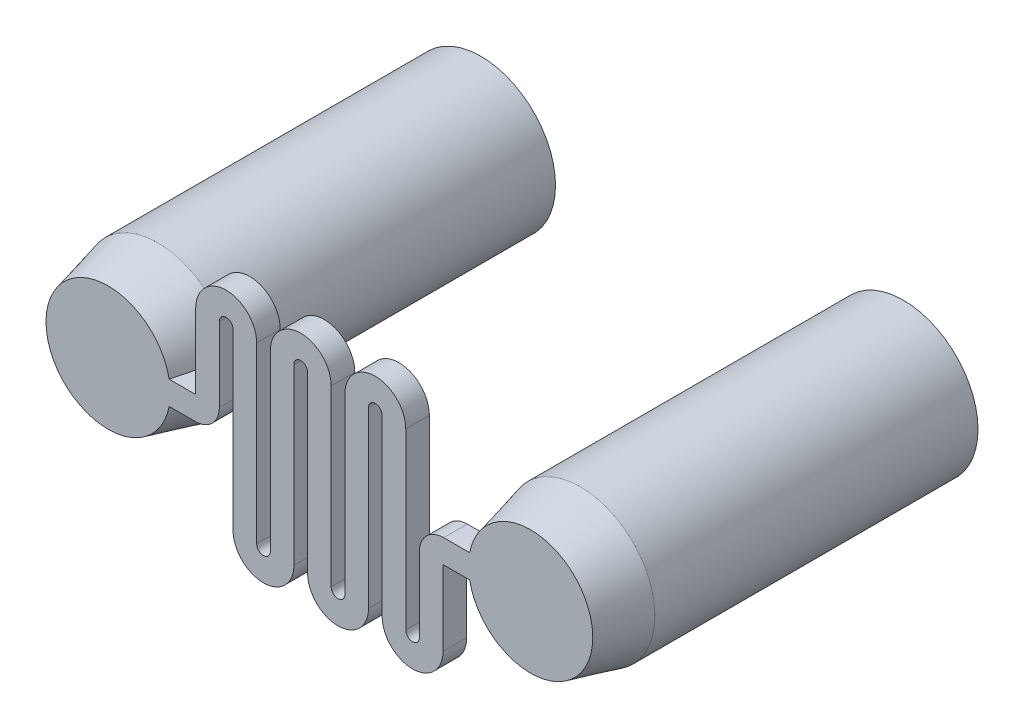
from build123d import *

# Parameters (mm, degrees)
BOSS_EXTRUDE1_DEPTH = 1.9
SKETCH5_R           = 5
CUT_EXTRUDE1_DEPTH  = 28


with BuildPart() as part:
    # Sketch2 → Boss-Extrude1 (new body)
    with BuildSketch(Plane.XY):
        with BuildLine():
            Line((-20.5, -0.95), (-13.5, -0.95))
            ThreePointArc((-13.5, -0.95), (-12.121141777, -0.378858223), (-11.55, 1))
            Line((-11.55, 1), (-11.55, 7))
            ThreePointArc((-11.55, 7), (-11, 7.55), (-10.45, 7))
            Line((-10.45, 7), (-10.45, 0))
            Line((-10.45, 0), (-10.45, -7))
            ThreePointArc((-10.45, -7), (-8, -9.45), (-5.55, -7))
            Line((-5.55, -7), (-5.55, 0))
            Line((-5.55, 0), (-5.55, 7))
            ThreePointArc((-5.55, 7), (-5, 7.55), (-4.45, 7))
            Line((-4.45, 7), (-4.45, 0))
            Line((-4.45, 0), (-4.45, -7))
            ThreePointArc((-4.45, -7), (-2, -9.45), (0.45, -7))
            Line((0.45, -7), (0.45, 0))
            Line((0.45, 0), (0.45, 7))
            ThreePointArc((0.45, 7), (1, 7.55), (1.55, 7))
            Line((1.55, 7), (1.55, 0))
            Line((1.55, 0), (1.55, -7))
            ThreePointArc((1.55, -7), (4, -9.45), (6.45, -7))
            Line((6.45, -7), (6.45, -1))
            ThreePointArc((6.45, -1), (6.464644661, -0.964644661), (6.5, -0.95))
            Line((6.5, -0.95), (13.5, -0.95))
            ThreePointArc((13.5, -0.95), (14.45, 0), (13.5, 0.95))
            Line((13.5, 0.95), (6.5, 0.95))
            ThreePointArc((6.5, 0.95), (5.121141777, 0.378858223), (4.55, -1))
            Line((4.55, -1), (4.55, -7))
            ThreePointArc((4.55, -7), (4, -7.55), (3.45, -7))
            Line((3.45, -7), (3.45, 0))
            Line((3.45, 0), (3.45, 7))
            ThreePointArc((3.45, 7), (1, 9.45), (-1.45, 7))
            Line((-1.45, 7), (-1.45, 0))
            Line((-1.45, 0), (-1.45, -7))
            ThreePointArc((-1.45, -7), (-2, -7.55), (-2.55, -7))
            Line((-2.55, -7), (-2.55, 0))
            Line((-2.55, 0), (-2.55, 7))
            ThreePointArc((-2.55, 7), (-5, 9.45), (-7.45, 7))
            Line((-7.45, 7), (-7.45, 0))
            Line((-7.45, 0), (-7.45, -7))
            ThreePointArc((-7.45, -7), (-8, -7.55), (-8.55, -7))
            Line((-8.55, -7), (-8.55, 0))
            Line((-8.55, 0), (-8.55, 7))
            ThreePointArc((-8.55, 7), (-11, 9.45), (-13.45, 7))
            Line((-13.45, 7), (-13.45, 1))
            ThreePointArc((-13.45, 1), (-13.464644661, 0.964644661), (-13.5, 0.95))
            Line((-13.5, 0.95), (-20.5, 0.95))
            ThreePointArc((-20.5, 0.95), (-21.45, 0), (-20.5, -0.95))
        make_face()
    extrude(amount=BOSS_EXTRUDE1_DEPTH)

    # Sketch3 → Revolve1 (revolve)
    with BuildSketch(Plane(origin=(0, 0, 0), x_dir=(1, 0, 0), z_dir=(0, 1, 0)), mode=Mode.PRIVATE) as revolve1_sk:
        Polygon((-20.5, -1.9), (-25.5, -1.9), (-26.5, 2.1), (-26.5, 28.1), (-20.5, 28.1), align=None)
    revolve(revolve1_sk.sketch.rotate(Axis((-20.5, 0, 1.9), (0, 0, -1)), 190.952784348), axis=Axis((-20.5, 0, 1.9), (0, 0, -1)))

    # Sketch4 → Revolve2 (revolve)
    with BuildSketch(Plane(origin=(0, 0, 0), x_dir=(1, 0, 0), z_dir=(0, 1, 0)), mode=Mode.PRIVATE) as revolve2_sk:
        Polygon((13.5, -1.9), (18.5, -1.9), (19.5, 2.1), (19.5, 28.1), (13.5, 28.1), align=None)
    revolve(revolve2_sk.sketch.rotate(Axis((13.5, 0, 1.9), (0, 0, -1)), 170.007691984), axis=Axis((13.5, 0, 1.9), (0, 0, -1)))

    # Sketch5 → Cut-Extrude1 (cut)
    with BuildSketch(Plane(origin=(0, 0, -28.1), x_dir=(-1, 0, 0), z_dir=(0, 0, -1))):
        with Locations((-13.5, 0)):
            Circle(SKETCH5_R)
        with Locations((20.5, 0)):
            Circle(SKETCH5_R)
    extrude(amount=-CUT_EXTRUDE1_DEPTH, mode=Mode.SUBTRACT)


solid = part.part
